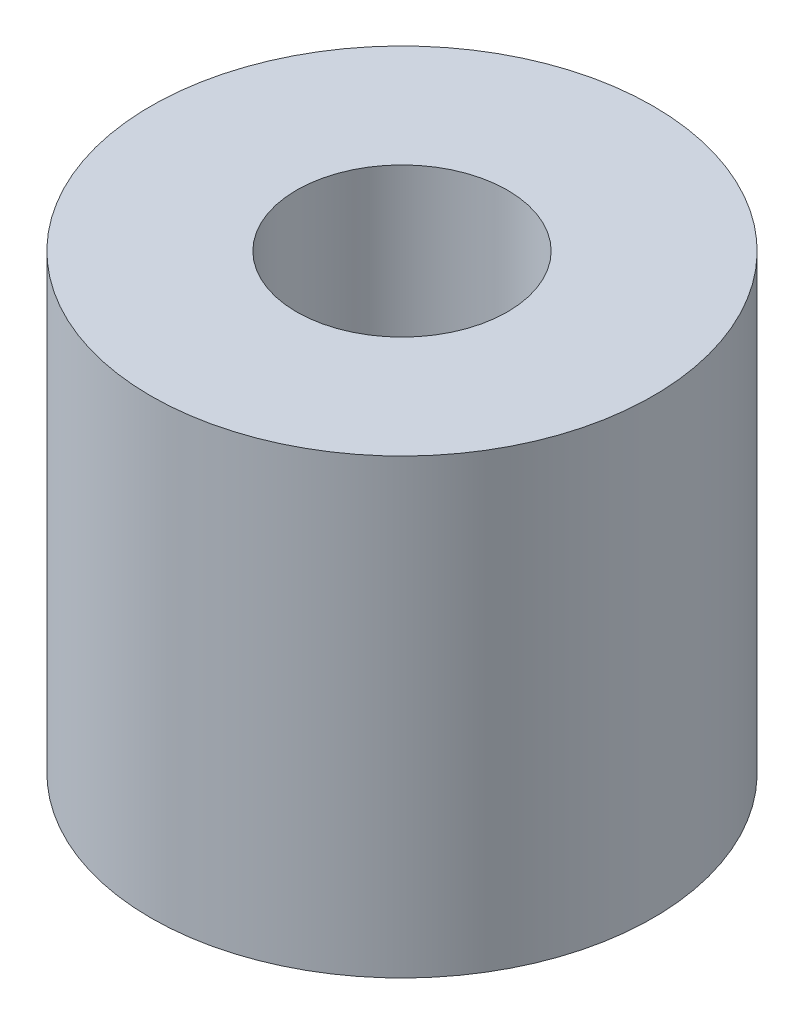
from build123d import *

# Parameters (mm, degrees)
SZKIC1_R                    = 5
SZKIC1_R_2                  = 2.1
DODANIE_WYCI_GNI_CIE1_DEPTH = 9


with BuildPart() as part:
    # Szkic1 → Dodanie-wyciągnięcie1 (new body)
    with BuildSketch(Plane(origin=(0, 0, 0), x_dir=(1, 0, 0), z_dir=(0, 1, 0))):
        with Locations(Location((0, 0, 0), (0, 0, 270))):
            Circle(SZKIC1_R)
        with Locations(Location((0, 0, 0), (0, 0, 270))):
            Circle(SZKIC1_R_2, mode=Mode.SUBTRACT)
    extrude(amount=DODANIE_WYCI_GNI_CIE1_DEPTH)


solid = part.part
